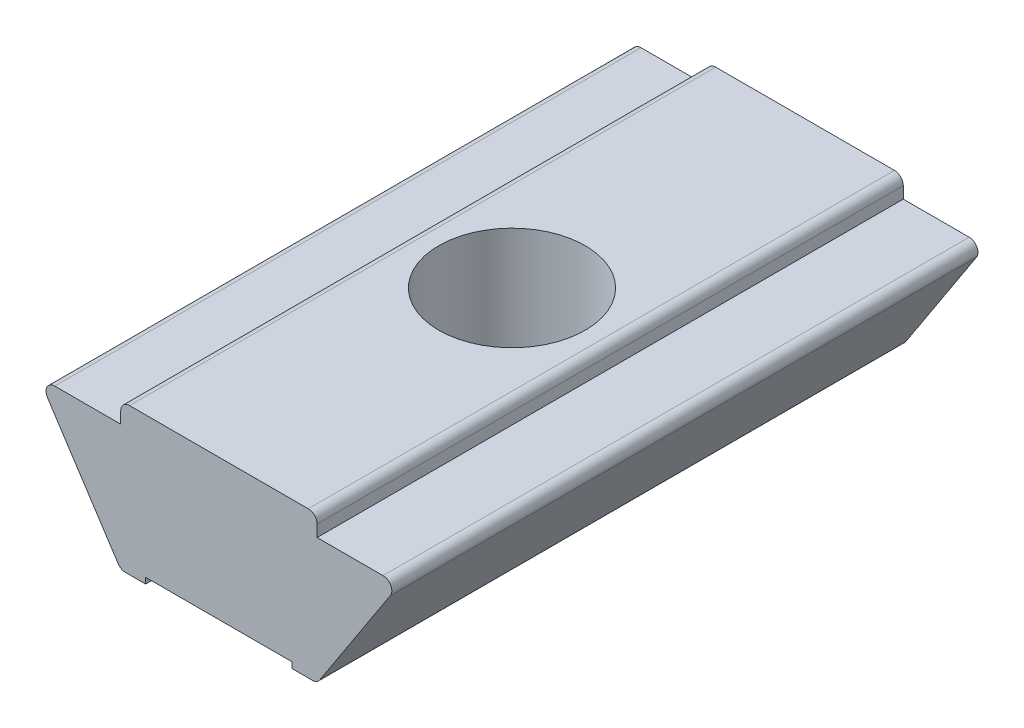
from build123d import *

# Parameters (mm, degrees)
EXTRUDE_1_DEPTH     = 10
HOLE_WIZARD_M6_1_D  = 5
SKETCH_5_W          = 5
SKETCH_5_H          = 0.2
CUT_EXTRUDE_1_DEPTH = 10
EXTRUDE_2_DEPTH     = 2.5
CUT_EXTRUDE_2_DEPTH = 0.3


with BuildPart() as part:
    # 草图1 → 凸台-拉伸1 (new, symmetric)
    with BuildSketch(Plane.XY):
        with BuildLine():
            Line((-0.162539896, 4.7), (-0.162539896, 4.3))
            Line((-0.162539896, 4.3), (-2.412539896, 4.3))
            ThreePointArc((-2.412539896, 4.3), (-2.673218708, 4.148480829), (-2.670578604, 3.846977045))
            Line((-2.670578604, 3.846977045), (-0.251308863, 0.136159055))
            ThreePointArc((-0.251308863, 0.136159055), (-0.142912065, 0.036227102), (0, 0))
            Line((0, 0), (6.374920209, 0))
            ThreePointArc((6.374920209, 0), (6.517832273, 0.036227102), (6.626229072, 0.136159055))
            Line((6.626229072, 0.136159055), (9.045498813, 3.846977045))
            ThreePointArc((9.045498813, 3.846977045), (9.048138917, 4.148480829), (8.787460104, 4.3))
            Line((8.787460104, 4.3), (6.537460104, 4.3))
            Line((6.537460104, 4.3), (6.537460104, 4.7))
            ThreePointArc((6.537460104, 4.7), (6.449592139, 4.912132034), (6.237460104, 5))
            Line((6.237460104, 5), (0.137460104, 5))
            ThreePointArc((0.137460104, 5), (-0.07467193, 4.912132034), (-0.162539896, 4.7))
        make_face()
    extrude(amount=EXTRUDE_1_DEPTH, both=True)

    # M6 螺纹孔1 (through all)
    with Locations(Plane(origin=(3.187460104, 5, 0), x_dir=(1, 0, 0), z_dir=(0, 1, 0))):
        with Locations((0, 0)):
            Hole(HOLE_WIZARD_M6_1_D / 2)

    # 草图5 → 切除-拉伸1 (cut)
    with BuildSketch(Plane.XY.offset(10)):
        with Locations((3.187460104, 0.1)):
            Rectangle(SKETCH_5_W, SKETCH_5_H)
    extrude(amount=-CUT_EXTRUDE_1_DEPTH, mode=Mode.SUBTRACT)

    # 草图6 → 凸台-拉伸2 (add, symmetric)
    with BuildSketch(Plane.ZY.offset(-3.187460104)):
        Polygon((3.00315896, 0.2), (-2.998839756, -2.5), (-3.039864859, -2.408802736), (3.00315896, 0.309652412), align=None)
    extrude(amount=EXTRUDE_2_DEPTH, both=True)

    # 草图7 → 切除-拉伸2 (cut)
    with BuildSketch(Plane(origin=(0, -0.957256199, 0.430621841), x_dir=(1, 0, 0), z_dir=(-1.0372120907131427e-12, -0.9119726400165361, 0.41025102542378794))):
        with BuildLine():
            Line((5.687460104, 0.830780993), (4.156276113, -3.008268608))
            ThreePointArc((4.156276113, -3.008268608), (3.187460104, -3.760487373), (2.218644095, -3.008268608))
            Line((2.218644095, -3.008268608), (0.687460104, 0.830780993))
            Line((0.687460104, 0.830780993), (-4.835906094, -0.220154239))
            Line((-4.835906094, -0.220154239), (4.418162479, -8.671425065))
            Line((4.418162479, -8.671425065), (7.352023336, -1.665190183))
            Line((7.352023336, -1.665190183), (5.687460104, 0.830780993))
        make_face()
    extrude(amount=-CUT_EXTRUDE_2_DEPTH, mode=Mode.SUBTRACT)


solid = part.part
